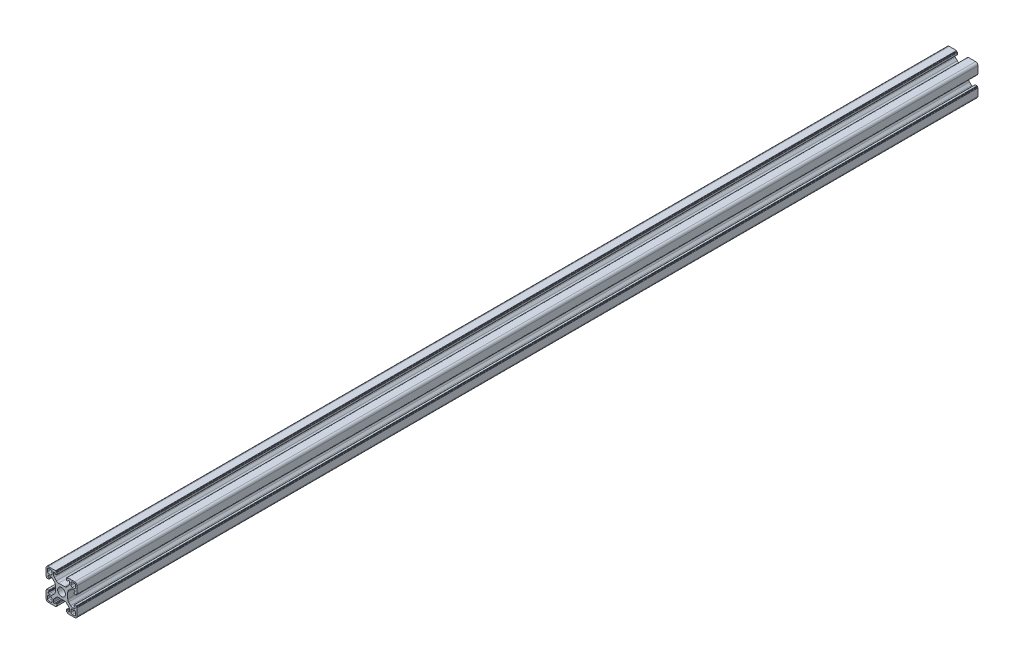
from build123d import *

# Parameters (mm, degrees)
EXTRUDE_1_DEPTH = 580


with BuildPart() as part:
    # Эскиз1 → Бобышка-Вытянуть1 (new body)
    with BuildSketch(Plane.XY):
        with BuildLine():
            Line((-31.105150957, 65.209647948), (-29.206370287, 65.209647948))
            ThreePointArc((-29.206370287, 65.209647948), (-28.441003423, 65.361888883), (-27.792156725, 65.795434385))
            Line((-27.792156725, 65.795434385), (-26.490937394, 67.096653716))
            ThreePointArc((-26.490937394, 67.096653716), (-26.057391892, 67.745500414), (-25.905150957, 68.510867279))
            Line((-25.905150957, 68.510867279), (-25.905150957, 69.409647948))
            ThreePointArc((-25.905150957, 69.409647948), (-26.051597566, 69.763201338), (-26.405150957, 69.909647948))
            Line((-26.405150957, 69.909647948), (-26.508044175, 69.909647948))
            ThreePointArc((-26.508044175, 69.909647948), (-26.699385892, 69.871587714), (-26.861597566, 69.763201338))
            Line((-26.861597566, 69.763201338), (-27.341927652, 69.282871252))
            ThreePointArc((-27.341927652, 69.282871252), (-27.423033489, 69.228678065), (-27.518704347, 69.209647948))
            Line((-27.518704347, 69.209647948), (-27.805150957, 69.209647948))
            ThreePointArc((-27.805150957, 69.209647948), (-27.981927652, 69.282871252), (-28.055150957, 69.459647948))
            Line((-28.055150957, 69.459647948), (-28.055150957, 70.608718768))
            ThreePointArc((-28.055150957, 70.608718768), (-28.011216974, 70.714784785), (-27.905150957, 70.758718768))
            Line((-27.905150957, 70.758718768), (-27.405150957, 70.758718768))
            Line((-27.405150957, 70.758718768), (-27.405150957, 71.059647948))
            ThreePointArc((-27.405150957, 71.059647948), (-27.361216974, 71.165713965), (-27.255150957, 71.209647948))
            Line((-27.255150957, 71.209647948), (-22.605150957, 71.209647948))
            ThreePointArc((-22.605150957, 71.209647948), (-21.544490785, 70.770308119), (-21.105150957, 69.709647948))
            Line((-21.105150957, 69.709647948), (-21.105150957, 65.059647948))
            ThreePointArc((-21.105150957, 65.059647948), (-21.149084939, 64.953581931), (-21.255150957, 64.909647948))
            Line((-21.255150957, 64.909647948), (-21.556080136, 64.909647948))
            Line((-21.556080136, 64.909647948), (-21.556080136, 64.409647948))
            ThreePointArc((-21.556080136, 64.409647948), (-21.600014119, 64.303581931), (-21.706080136, 64.259647948))
            Line((-21.706080136, 64.259647948), (-22.855150957, 64.259647948))
            ThreePointArc((-22.855150957, 64.259647948), (-23.031927652, 64.332871252), (-23.105150957, 64.509647948))
            Line((-23.105150957, 64.509647948), (-23.105150957, 64.796094557))
            ThreePointArc((-23.105150957, 64.796094557), (-23.08612084, 64.891765415), (-23.031927652, 64.972871252))
            Line((-23.031927652, 64.972871252), (-22.551597566, 65.453201338))
            ThreePointArc((-22.551597566, 65.453201338), (-22.44321119, 65.615413013), (-22.405150957, 65.806754729))
            Line((-22.405150957, 65.806754729), (-22.405150957, 65.909647948))
            ThreePointArc((-22.405150957, 65.909647948), (-22.551597566, 66.263201338), (-22.905150957, 66.409647948))
            Line((-22.905150957, 66.409647948), (-23.803931626, 66.409647948))
            ThreePointArc((-23.803931626, 66.409647948), (-24.56929849, 66.257407013), (-25.218145188, 65.82386151))
            Line((-25.218145188, 65.82386151), (-26.519364519, 64.522642179))
            ThreePointArc((-26.519364519, 64.522642179), (-26.952910022, 63.873795482), (-27.105150957, 63.108428617))
            Line((-27.105150957, 63.108428617), (-27.105150957, 61.209647948))
            Line((-27.105150957, 61.209647948), (-27.105150957, 59.310867279))
            ThreePointArc((-27.105150957, 59.310867279), (-26.952910022, 58.545500414), (-26.519364519, 57.896653716))
            Line((-26.519364519, 57.896653716), (-25.218145188, 56.595434385))
            ThreePointArc((-25.218145188, 56.595434385), (-24.56929849, 56.161888883), (-23.803931626, 56.009647948))
            Line((-23.803931626, 56.009647948), (-22.905150957, 56.009647948))
            ThreePointArc((-22.905150957, 56.009647948), (-22.551597566, 56.156094557), (-22.405150957, 56.509647948))
            Line((-22.405150957, 56.509647948), (-22.405150957, 56.612541166))
            ThreePointArc((-22.405150957, 56.612541166), (-22.44321119, 56.803882883), (-22.551597566, 56.966094557))
            Line((-22.551597566, 56.966094557), (-23.031927652, 57.446424643))
            ThreePointArc((-23.031927652, 57.446424643), (-23.08612084, 57.52753048), (-23.105150957, 57.623201338))
            Line((-23.105150957, 57.623201338), (-23.105150957, 57.909647948))
            ThreePointArc((-23.105150957, 57.909647948), (-23.031927652, 58.086424643), (-22.855150957, 58.159647948))
            Line((-22.855150957, 58.159647948), (-21.706080136, 58.159647948))
            ThreePointArc((-21.706080136, 58.159647948), (-21.600014119, 58.115713965), (-21.556080136, 58.009647948))
            Line((-21.556080136, 58.009647948), (-21.556080136, 57.509647948))
            Line((-21.556080136, 57.509647948), (-21.255150957, 57.509647948))
            ThreePointArc((-21.255150957, 57.509647948), (-21.149084939, 57.465713965), (-21.105150957, 57.359647948))
            Line((-21.105150957, 57.359647948), (-21.105150957, 52.709647948))
            ThreePointArc((-21.105150957, 52.709647948), (-21.544490785, 51.648987776), (-22.605150957, 51.209647948))
            Line((-22.605150957, 51.209647948), (-27.255150957, 51.209647948))
            ThreePointArc((-27.255150957, 51.209647948), (-27.361216974, 51.253581931), (-27.405150957, 51.359647948))
            Line((-27.405150957, 51.359647948), (-27.405150957, 51.660577127))
            Line((-27.405150957, 51.660577127), (-27.905150957, 51.660577127))
            ThreePointArc((-27.905150957, 51.660577127), (-28.011216974, 51.70451111), (-28.055150957, 51.810577127))
            Line((-28.055150957, 51.810577127), (-28.055150957, 52.959647948))
            ThreePointArc((-28.055150957, 52.959647948), (-27.981927652, 53.136424643), (-27.805150957, 53.209647948))
            Line((-27.805150957, 53.209647948), (-27.518704347, 53.209647948))
            ThreePointArc((-27.518704347, 53.209647948), (-27.423033489, 53.190617831), (-27.341927652, 53.136424643))
            Line((-27.341927652, 53.136424643), (-26.861597566, 52.656094557))
            ThreePointArc((-26.861597566, 52.656094557), (-26.699385892, 52.547708181), (-26.508044175, 52.509647948))
            Line((-26.508044175, 52.509647948), (-26.405150957, 52.509647948))
            ThreePointArc((-26.405150957, 52.509647948), (-26.051597566, 52.656094557), (-25.905150957, 53.009647948))
            Line((-25.905150957, 53.009647948), (-25.905150957, 53.908428617))
            ThreePointArc((-25.905150957, 53.908428617), (-26.057391892, 54.673795482), (-26.490937394, 55.322642179))
            Line((-26.490937394, 55.322642179), (-27.792156725, 56.62386151))
            ThreePointArc((-27.792156725, 56.62386151), (-28.441003423, 57.057407013), (-29.206370287, 57.209647948))
            Line((-29.206370287, 57.209647948), (-31.105150957, 57.209647948))
            Line((-31.105150957, 57.209647948), (-33.003931626, 57.209647948))
            ThreePointArc((-33.003931626, 57.209647948), (-33.76929849, 57.057407013), (-34.418145188, 56.62386151))
            Line((-34.418145188, 56.62386151), (-35.719364519, 55.322642179))
            ThreePointArc((-35.719364519, 55.322642179), (-36.152910022, 54.673795482), (-36.305150957, 53.908428617))
            Line((-36.305150957, 53.908428617), (-36.305150957, 53.009647948))
            ThreePointArc((-36.305150957, 53.009647948), (-36.158704347, 52.656094557), (-35.805150957, 52.509647948))
            Line((-35.805150957, 52.509647948), (-35.702257738, 52.509647948))
            ThreePointArc((-35.702257738, 52.509647948), (-35.510916022, 52.547708181), (-35.348704347, 52.656094557))
            Line((-35.348704347, 52.656094557), (-34.868374261, 53.136424643))
            ThreePointArc((-34.868374261, 53.136424643), (-34.787268424, 53.190617831), (-34.691597566, 53.209647948))
            Line((-34.691597566, 53.209647948), (-34.405150957, 53.209647948))
            ThreePointArc((-34.405150957, 53.209647948), (-34.228374261, 53.136424643), (-34.155150957, 52.959647948))
            Line((-34.155150957, 52.959647948), (-34.155150957, 51.810577127))
            ThreePointArc((-34.155150957, 51.810577127), (-34.199084939, 51.70451111), (-34.305150957, 51.660577127))
            Line((-34.305150957, 51.660577127), (-34.805150957, 51.660577127))
            Line((-34.805150957, 51.660577127), (-34.805150957, 51.359647948))
            ThreePointArc((-34.805150957, 51.359647948), (-34.849084939, 51.253581931), (-34.955150957, 51.209647948))
            Line((-34.955150957, 51.209647948), (-39.605150957, 51.209647948))
            ThreePointArc((-39.605150957, 51.209647948), (-40.665811128, 51.648987776), (-41.105150957, 52.709647948))
            Line((-41.105150957, 52.709647948), (-41.105150957, 57.359647948))
            ThreePointArc((-41.105150957, 57.359647948), (-41.061216974, 57.465713965), (-40.955150957, 57.509647948))
            Line((-40.955150957, 57.509647948), (-40.654221777, 57.509647948))
            Line((-40.654221777, 57.509647948), (-40.654221777, 58.009647948))
            ThreePointArc((-40.654221777, 58.009647948), (-40.610287794, 58.115713965), (-40.504221777, 58.159647948))
            Line((-40.504221777, 58.159647948), (-39.355150957, 58.159647948))
            ThreePointArc((-39.355150957, 58.159647948), (-39.178374261, 58.086424643), (-39.105150957, 57.909647948))
            Line((-39.105150957, 57.909647948), (-39.105150957, 57.623201338))
            ThreePointArc((-39.105150957, 57.623201338), (-39.124181073, 57.52753048), (-39.178374261, 57.446424643))
            Line((-39.178374261, 57.446424643), (-39.658704347, 56.966094557))
            ThreePointArc((-39.658704347, 56.966094557), (-39.767090723, 56.803882883), (-39.805150957, 56.612541166))
            Line((-39.805150957, 56.612541166), (-39.805150957, 56.509647948))
            ThreePointArc((-39.805150957, 56.509647948), (-39.658704347, 56.156094557), (-39.305150957, 56.009647948))
            Line((-39.305150957, 56.009647948), (-38.406370287, 56.009647948))
            ThreePointArc((-38.406370287, 56.009647948), (-37.641003423, 56.161888883), (-36.992156725, 56.595434385))
            Line((-36.992156725, 56.595434385), (-35.690937394, 57.896653716))
            ThreePointArc((-35.690937394, 57.896653716), (-35.257391892, 58.545500414), (-35.105150957, 59.310867279))
            Line((-35.105150957, 59.310867279), (-35.105150957, 61.209647948))
            Line((-35.105150957, 61.209647948), (-35.105150957, 63.108428617))
            ThreePointArc((-35.105150957, 63.108428617), (-35.257391892, 63.873795482), (-35.690937394, 64.522642179))
            Line((-35.690937394, 64.522642179), (-36.992156725, 65.82386151))
            ThreePointArc((-36.992156725, 65.82386151), (-37.641003423, 66.257407013), (-38.406370287, 66.409647948))
            Line((-38.406370287, 66.409647948), (-39.305150957, 66.409647948))
            ThreePointArc((-39.305150957, 66.409647948), (-39.658704347, 66.263201338), (-39.805150957, 65.909647948))
            Line((-39.805150957, 65.909647948), (-39.805150957, 65.806754729))
            ThreePointArc((-39.805150957, 65.806754729), (-39.767090723, 65.615413013), (-39.658704347, 65.453201338))
            Line((-39.658704347, 65.453201338), (-39.178374261, 64.972871252))
            ThreePointArc((-39.178374261, 64.972871252), (-39.124181073, 64.891765415), (-39.105150957, 64.796094557))
            Line((-39.105150957, 64.796094557), (-39.105150957, 64.509647948))
            ThreePointArc((-39.105150957, 64.509647948), (-39.178374261, 64.332871252), (-39.355150957, 64.259647948))
            Line((-39.355150957, 64.259647948), (-40.504221777, 64.259647948))
            ThreePointArc((-40.504221777, 64.259647948), (-40.610287794, 64.303581931), (-40.654221777, 64.409647948))
            Line((-40.654221777, 64.409647948), (-40.654221777, 64.909647948))
            Line((-40.654221777, 64.909647948), (-40.955150957, 64.909647948))
            ThreePointArc((-40.955150957, 64.909647948), (-41.061216974, 64.953581931), (-41.105150957, 65.059647948))
            Line((-41.105150957, 65.059647948), (-41.105150957, 69.709647948))
            ThreePointArc((-41.105150957, 69.709647948), (-40.665811128, 70.770308119), (-39.605150957, 71.209647948))
            Line((-39.605150957, 71.209647948), (-34.955150957, 71.209647948))
            ThreePointArc((-34.955150957, 71.209647948), (-34.849084939, 71.165713965), (-34.805150957, 71.059647948))
            Line((-34.805150957, 71.059647948), (-34.805150957, 70.758718768))
            Line((-34.805150957, 70.758718768), (-34.305150957, 70.758718768))
            ThreePointArc((-34.305150957, 70.758718768), (-34.199084939, 70.714784785), (-34.155150957, 70.608718768))
            Line((-34.155150957, 70.608718768), (-34.155150957, 69.459647948))
            ThreePointArc((-34.155150957, 69.459647948), (-34.228374261, 69.282871252), (-34.405150957, 69.209647948))
            Line((-34.405150957, 69.209647948), (-34.691597566, 69.209647948))
            ThreePointArc((-34.691597566, 69.209647948), (-34.787268424, 69.228678065), (-34.868374261, 69.282871252))
            Line((-34.868374261, 69.282871252), (-35.348704347, 69.763201338))
            ThreePointArc((-35.348704347, 69.763201338), (-35.510916022, 69.871587714), (-35.702257738, 69.909647948))
            Line((-35.702257738, 69.909647948), (-35.805150957, 69.909647948))
            ThreePointArc((-35.805150957, 69.909647948), (-36.158704347, 69.763201338), (-36.305150957, 69.409647948))
            Line((-36.305150957, 69.409647948), (-36.305150957, 68.510867279))
            ThreePointArc((-36.305150957, 68.510867279), (-36.152910022, 67.745500414), (-35.719364519, 67.096653716))
            Line((-35.719364519, 67.096653716), (-34.418145188, 65.795434385))
            ThreePointArc((-34.418145188, 65.795434385), (-33.76929849, 65.361888883), (-33.003931626, 65.209647948))
            Line((-33.003931626, 65.209647948), (-31.105150957, 65.209647948))
        make_face()
        with BuildLine():
            Line((-24.205150957, 67.309647948), (-22.805150957, 67.309647948))
            ThreePointArc((-22.805150957, 67.309647948), (-22.239465532, 67.543962523), (-22.005150957, 68.109647948))
            Line((-22.005150957, 68.109647948), (-22.005150957, 69.509647948))
            ThreePointArc((-22.005150957, 69.509647948), (-22.239465532, 70.075333373), (-22.805150957, 70.309647948))
            Line((-22.805150957, 70.309647948), (-24.205150957, 70.309647948))
            ThreePointArc((-24.205150957, 70.309647948), (-24.770836381, 70.075333373), (-25.005150957, 69.509647948))
            Line((-25.005150957, 69.509647948), (-25.005150957, 68.109647948))
            ThreePointArc((-25.005150957, 68.109647948), (-24.770836381, 67.543962523), (-24.205150957, 67.309647948))
        make_face(mode=Mode.SUBTRACT)
        with BuildLine():
            Line((-25.005150957, 54.309647948), (-25.005150957, 52.909647948))
            ThreePointArc((-25.005150957, 52.909647948), (-24.770836381, 52.343962523), (-24.205150957, 52.109647948))
            Line((-24.205150957, 52.109647948), (-22.805150957, 52.109647948))
            ThreePointArc((-22.805150957, 52.109647948), (-22.239465532, 52.343962523), (-22.005150957, 52.909647948))
            Line((-22.005150957, 52.909647948), (-22.005150957, 54.309647948))
            ThreePointArc((-22.005150957, 54.309647948), (-22.239465532, 54.875333373), (-22.805150957, 55.109647948))
            Line((-22.805150957, 55.109647948), (-24.205150957, 55.109647948))
            ThreePointArc((-24.205150957, 55.109647948), (-24.770836381, 54.875333373), (-25.005150957, 54.309647948))
        make_face(mode=Mode.SUBTRACT)
        with BuildLine():
            Line((-38.005150957, 55.109647948), (-39.405150957, 55.109647948))
            ThreePointArc((-39.405150957, 55.109647948), (-39.970836381, 54.875333373), (-40.205150957, 54.309647948))
            Line((-40.205150957, 54.309647948), (-40.205150957, 52.909647948))
            ThreePointArc((-40.205150957, 52.909647948), (-39.970836381, 52.343962523), (-39.405150957, 52.109647948))
            Line((-39.405150957, 52.109647948), (-38.005150957, 52.109647948))
            ThreePointArc((-38.005150957, 52.109647948), (-37.439465532, 52.343962523), (-37.205150957, 52.909647948))
            Line((-37.205150957, 52.909647948), (-37.205150957, 54.309647948))
            ThreePointArc((-37.205150957, 54.309647948), (-37.439465532, 54.875333373), (-38.005150957, 55.109647948))
        make_face(mode=Mode.SUBTRACT)
        with BuildLine():
            Line((-37.205150957, 68.109647948), (-37.205150957, 69.509647948))
            ThreePointArc((-37.205150957, 69.509647948), (-37.439465532, 70.075333373), (-38.005150957, 70.309647948))
            Line((-38.005150957, 70.309647948), (-39.405150957, 70.309647948))
            ThreePointArc((-39.405150957, 70.309647948), (-39.970836381, 70.075333373), (-40.205150957, 69.509647948))
            Line((-40.205150957, 69.509647948), (-40.205150957, 68.109647948))
            ThreePointArc((-40.205150957, 68.109647948), (-39.970836381, 67.543962523), (-39.405150957, 67.309647948))
            Line((-39.405150957, 67.309647948), (-38.005150957, 67.309647948))
            ThreePointArc((-38.005150957, 67.309647948), (-37.439465532, 67.543962523), (-37.205150957, 68.109647948))
        make_face(mode=Mode.SUBTRACT)
        with BuildLine():
            ThreePointArc((-28.605150957, 61.209647948), (-29.337384004, 62.977414901), (-31.105150957, 63.709647948))
            ThreePointArc((-31.105150957, 63.709647948), (-32.87291791, 62.977414901), (-33.605150957, 61.209647948))
            ThreePointArc((-33.605150957, 61.209647948), (-32.87291791, 59.441880995), (-31.105150957, 58.709647948))
            ThreePointArc((-31.105150957, 58.709647948), (-29.337384004, 59.441880995), (-28.605150957, 61.209647948))
        make_face(mode=Mode.SUBTRACT)
    extrude(amount=EXTRUDE_1_DEPTH)


solid = part.part
